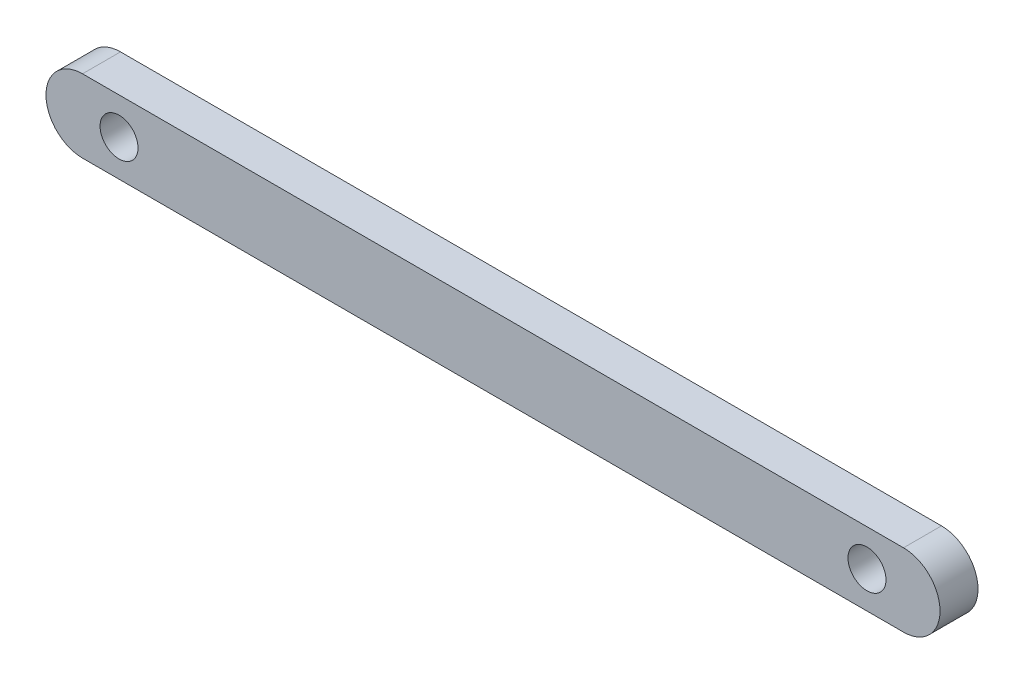
from build123d import *

# Parameters (mm, degrees)
BOSS_EXTRUDE1_DEPTH         = 3.302
F_1_8_0_13_DIAMETER_HOLE1_D = 3.302


with BuildPart() as part:
    # Sketch1 → Boss-Extrude1 (new body)
    with BuildSketch(Plane.XY):
        with BuildLine():
            Line((0, 3.175), (71.374, 3.175))
            ThreePointArc((71.374, 3.175), (74.549, 0), (71.374, -3.175))
            Line((71.374, -3.175), (0, -3.175))
            ThreePointArc((0, -3.175), (-3.175, 0), (0, 3.175))
        make_face()
    extrude(amount=BOSS_EXTRUDE1_DEPTH)

    # 1/8 (0.13) Diameter Hole1 (through all)
    with Locations(Plane.XY.offset(3.302)):
        with Locations((3.175, 0), (68.199, 0)):
            Hole(F_1_8_0_13_DIAMETER_HOLE1_D / 2)


solid = part.part
